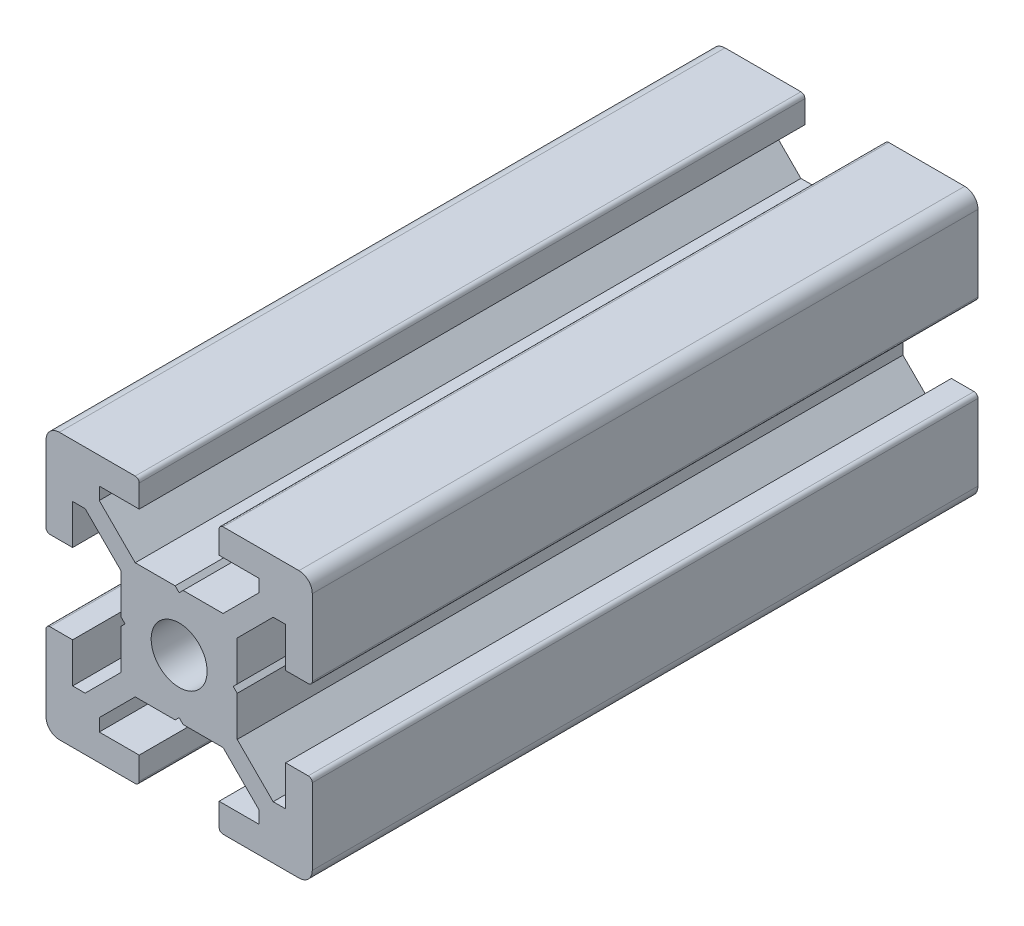
from build123d import *

# Parameters (mm, degrees)
SKETCH1_R           = 2.1
BOSS_EXTRUDE1_DEPTH = 50


with BuildPart() as part:
    # Sketch1 → Boss-Extrude1 (new body)
    with BuildSketch(Plane.XY):
        with BuildLine():
            Line((3.3, 4.360660172), (6.000039828, 7.0607))
            Line((6.000039828, 7.0607), (6.000039828, 8))
            Line((6.000039828, 8), (3.000039828, 8))
            Line((3.000039828, 8), (3.000039828, 9.7))
            ThreePointArc((3.000039828, 9.7), (3.087907794, 9.912132034), (3.300039828, 10))
            Line((3.300039828, 10), (9, 10))
            ThreePointArc((9, 10), (9.707106781, 9.707106781), (10, 9))
            Line((10, 9), (10, 3.300039828))
            ThreePointArc((10, 3.300039828), (9.912132034, 3.087907794), (9.7, 3.000039828))
            Line((9.7, 3.000039828), (8, 3.000039828))
            Line((8, 3.000039828), (8, 6.000039828))
            Line((8, 6.000039828), (7.0607, 6.000039828))
            Line((7.0607, 6.000039828), (4.360660172, 3.3))
            Line((4.360660172, 3.3), (4.360660172, 0.3))
            Line((4.360660172, 0.3), (4.060660172, 0))
            Line((4.060660172, 0), (4.360660172, -0.3))
            Line((4.360660172, -0.3), (4.360660172, -3.3))
            Line((4.360660172, -3.3), (7.0607, -6.000039828))
            Line((7.0607, -6.000039828), (8, -6.000039828))
            Line((8, -6.000039828), (8, -3.000039828))
            Line((8, -3.000039828), (9.7, -3.000039828))
            ThreePointArc((9.7, -3.000039828), (9.912132034, -3.087907794), (10, -3.300039828))
            Line((10, -3.300039828), (10, -9))
            ThreePointArc((10, -9), (9.707106781, -9.707106781), (9, -10))
            Line((9, -10), (3.300039828, -10))
            ThreePointArc((3.300039828, -10), (3.087907794, -9.912132034), (3.000039828, -9.7))
            Line((3.000039828, -9.7), (3.000039828, -8))
            Line((3.000039828, -8), (6.000039828, -8))
            Line((6.000039828, -8), (6.000039828, -7.0607))
            Line((6.000039828, -7.0607), (3.3, -4.360660172))
            Line((3.3, -4.360660172), (0.3, -4.360660172))
            Line((0.3, -4.360660172), (0, -4.060660172))
            Line((0, -4.060660172), (-0.3, -4.360660172))
            Line((-0.3, -4.360660172), (-3.3, -4.360660172))
            Line((-3.3, -4.360660172), (-6.000039828, -7.0607))
            Line((-6.000039828, -7.0607), (-6.000039828, -8))
            Line((-6.000039828, -8), (-3.000039828, -8))
            Line((-3.000039828, -8), (-3.000039828, -9.7))
            ThreePointArc((-3.000039828, -9.7), (-3.087907794, -9.912132034), (-3.300039828, -10))
            Line((-3.300039828, -10), (-9, -10))
            ThreePointArc((-9, -10), (-9.707106781, -9.707106781), (-10, -9))
            Line((-10, -9), (-10, -3.300039828))
            ThreePointArc((-10, -3.300039828), (-9.912132034, -3.087907794), (-9.7, -3.000039828))
            Line((-9.7, -3.000039828), (-8, -3.000039828))
            Line((-8, -3.000039828), (-8, -6.000039828))
            Line((-8, -6.000039828), (-7.0607, -6.000039828))
            Line((-7.0607, -6.000039828), (-4.360660172, -3.3))
            Line((-4.360660172, -3.3), (-4.360660172, -0.3))
            Line((-4.360660172, -0.3), (-4.060660172, 0))
            Line((-4.060660172, 0), (-4.360660172, 0.3))
            Line((-4.360660172, 0.3), (-4.360660172, 3.3))
            Line((-4.360660172, 3.3), (-7.0607, 6.000039828))
            Line((-7.0607, 6.000039828), (-8, 6.000039828))
            Line((-8, 6.000039828), (-8, 3.000039828))
            Line((-8, 3.000039828), (-9.7, 3.000039828))
            ThreePointArc((-9.7, 3.000039828), (-9.912132034, 3.087907794), (-10, 3.300039828))
            Line((-10, 3.300039828), (-10, 9))
            ThreePointArc((-10, 9), (-9.707106781, 9.707106781), (-9, 10))
            Line((-9, 10), (-3.300039828, 10))
            ThreePointArc((-3.300039828, 10), (-3.087907794, 9.912132034), (-3.000039828, 9.7))
            Line((-3.000039828, 9.7), (-3.000039828, 8))
            Line((-3.000039828, 8), (-6.000039828, 8))
            Line((-6.000039828, 8), (-6.000039828, 7.0607))
            Line((-6.000039828, 7.0607), (-3.3, 4.360660172))
            Line((-3.3, 4.360660172), (-0.3, 4.360660172))
            Line((-0.3, 4.360660172), (0, 4.060660172))
            Line((0, 4.060660172), (0.3, 4.360660172))
            Line((0.3, 4.360660172), (3.3, 4.360660172))
        make_face()
        Circle(SKETCH1_R, mode=Mode.SUBTRACT)
    extrude(amount=BOSS_EXTRUDE1_DEPTH)


solid = part.part
